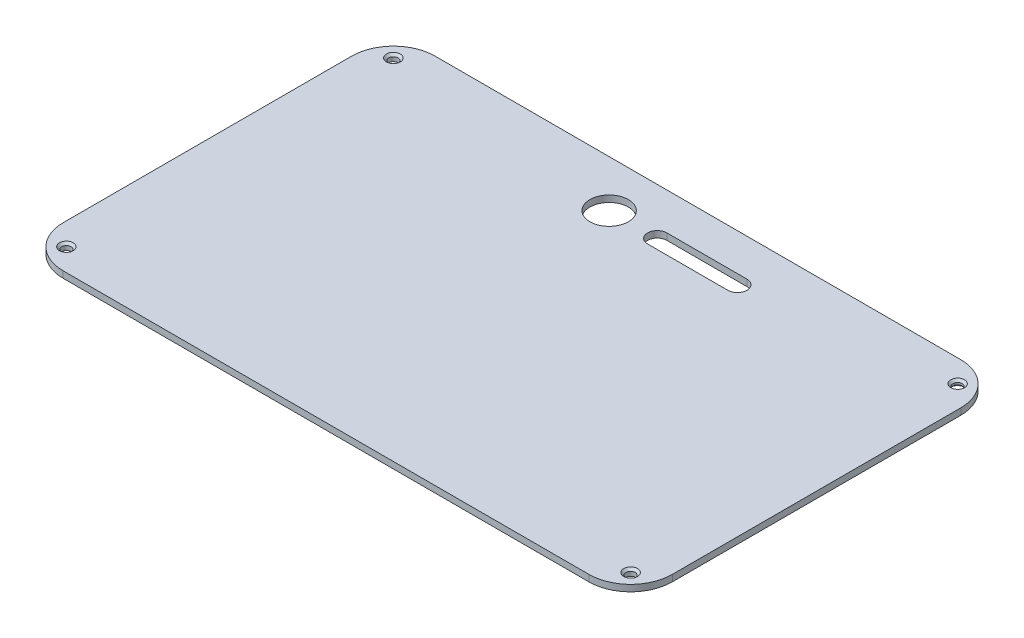
from build123d import *

# Parameters (mm, degrees)
BOSS_EXTRUDE1_DEPTH        = 1.016
F_2_9_2_9_DIAMETER_HOLE1_D = 2.9
CHAMFER1_SIZE              = 0.7
SKETCH4_R                  = 6
CUT_EXTRUDE1_DEPTH         = 112.324431389
CUT_EXTRUDE2_DEPTH         = 112.324431389


with BuildPart() as part:
    # Sketch1 → Boss-Extrude1 (new, symmetric)
    with BuildSketch(Plane(origin=(0, 0, 0), x_dir=(1, 0, 0), z_dir=(0, 1, 0))):
        with BuildLine():
            Line((-82, -58), (82, -58))
            ThreePointArc((82, -58), (91.192388155, -54.192388155), (95, -45))
            Line((95, -45), (95, 45))
            ThreePointArc((95, 45), (91.192388155, 54.192388155), (82, 58))
            Line((82, 58), (-82, 58))
            ThreePointArc((-82, 58), (-91.192388155, 54.192388155), (-95, 45))
            Line((-95, 45), (-95, -45))
            ThreePointArc((-95, -45), (-91.192388155, -54.192388155), (-82, -58))
        make_face()
    extrude(amount=BOSS_EXTRUDE1_DEPTH, both=True)

    # Ø2.9 (2.9) Diameter Hole1 (through all)
    with Locations(Plane(origin=(0, 1.016, 0), x_dir=(1, 0, 0), z_dir=(0, 1, 0))):
        with Locations((-88, -51), (-88, 51), (88, -51), (88, 51)):
            Hole(F_2_9_2_9_DIAMETER_HOLE1_D / 2)

    # Chamfer1
    chamfer1_edges = [part.edges().sort_by_distance(p)[0] for p in [
        (89.45, 1.016, -51),
        (89.45, -1.016, -51),
        (89.45, 1.016, 51),
        (-86.55, 1.016, -51),
        (-86.55, 1.016, 51),
    ]]
    chamfer(chamfer1_edges, length=CHAMFER1_SIZE)

    # Sketch4 → Cut-Extrude1 (cut, through all)
    with BuildSketch(Plane(origin=(0, 1.016, 0), x_dir=(1, 0, 0), z_dir=(0, 1, 0))):
        with Locations(Location((-13.1, 43.4, 0), (0, 0, 270))):
            Circle(SKETCH4_R)
    extrude(amount=-CUT_EXTRUDE1_DEPTH, mode=Mode.SUBTRACT)

    # Sketch5 → Cut-Extrude2 (cut, through all)
    with BuildSketch(Plane(origin=(0, 1.016, 0), x_dir=(1, 0, 0), z_dir=(0, 1, 0))):
        with BuildLine():
            Line((1.9, 46.4), (26.9, 46.4))
            ThreePointArc((26.9, 46.4), (29.9, 43.4), (26.9, 40.4))
            Line((26.9, 40.4), (1.9, 40.4))
            ThreePointArc((1.9, 40.4), (-1.1, 43.4), (1.9, 46.4))
        make_face()
    extrude(amount=-CUT_EXTRUDE2_DEPTH, mode=Mode.SUBTRACT)


solid = part.part
